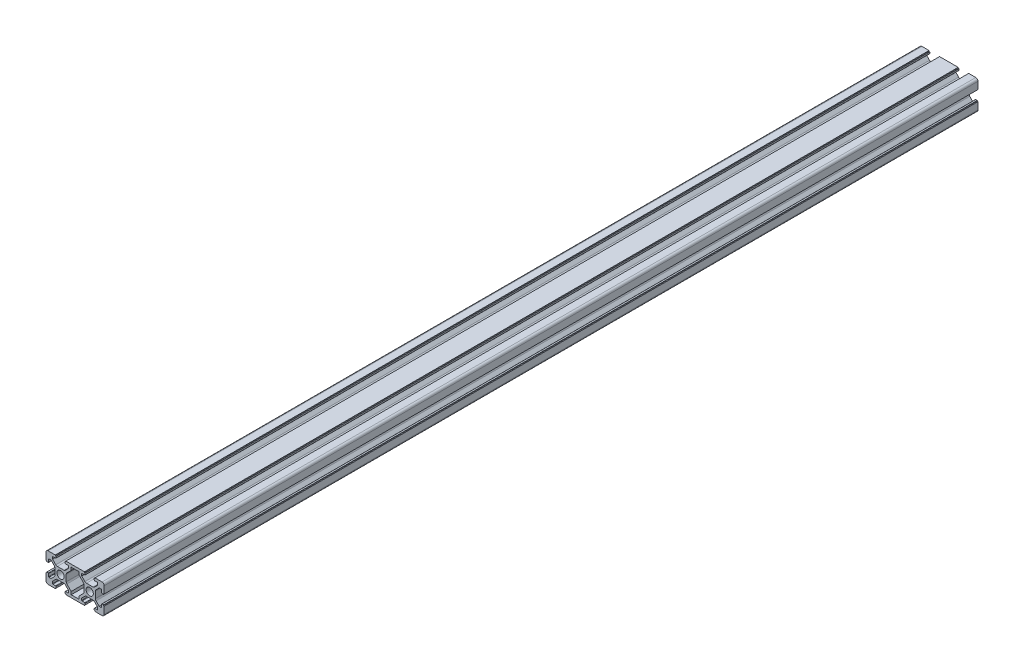
from build123d import *

# Parameters (mm, degrees)
SKETCH_1_R      = 2.5
EXTRUDE_1_DEPTH = 600


with BuildPart() as part:
    # 草图1 → 凸台-拉伸1 (new body)
    with BuildSketch(Plane.XY):
        with BuildLine():
            Line((-0.771587854, 9.545792426), (-5.671587854, 9.545792426))
            Line((-5.671587854, 9.545792426), (-5.671587854, 9.245792426))
            ThreePointArc((-5.671587854, 9.245792426), (-5.730166498, 9.10437107), (-5.871587854, 9.045792426))
            Line((-5.871587854, 9.045792426), (-6.171587854, 9.045792426))
            Line((-6.171587854, 9.045792426), (-6.171587854, 8.045792426))
            ThreePointArc((-6.171587854, 8.045792426), (-6.083719889, 7.833660392), (-5.871587854, 7.745792426))
            Line((-5.871587854, 7.745792426), (-4.071587854, 7.745792426))
            ThreePointArc((-4.071587854, 7.745792426), (-3.85945582, 7.657924461), (-3.771587854, 7.445792426))
            Line((-3.771587854, 7.445792426), (-3.771587854, 6.105792426))
            Line((-3.771587854, 6.105792426), (-5.992248026, 3.885132255))
            ThreePointArc((-5.992248026, 3.885132255), (-6.478883049, 3.559973128), (-7.052908198, 3.445792426))
            Line((-7.052908198, 3.445792426), (-11.490267511, 3.445792426))
            ThreePointArc((-11.490267511, 3.445792426), (-12.064292659, 3.559973128), (-12.550927682, 3.885132255))
            Line((-12.550927682, 3.885132255), (-14.771587854, 6.105792426))
            Line((-14.771587854, 6.105792426), (-14.771587854, 7.445792426))
            ThreePointArc((-14.771587854, 7.445792426), (-14.683719889, 7.657924461), (-14.471587854, 7.745792426))
            Line((-14.471587854, 7.745792426), (-12.671587854, 7.745792426))
            ThreePointArc((-12.671587854, 7.745792426), (-12.45945582, 7.833660392), (-12.371587854, 8.045792426))
            Line((-12.371587854, 8.045792426), (-12.371587854, 9.045792426))
            Line((-12.371587854, 9.045792426), (-12.671587854, 9.045792426))
            ThreePointArc((-12.671587854, 9.045792426), (-12.81300921, 9.10437107), (-12.871587854, 9.245792426))
            Line((-12.871587854, 9.245792426), (-12.871587854, 9.545792426))
            Line((-12.871587854, 9.545792426), (-17.771587854, 9.545792426))
            ThreePointArc((-17.771587854, 9.545792426), (-18.832248026, 9.106452598), (-19.271587854, 8.045792426))
            Line((-19.271587854, 8.045792426), (-19.271587854, 3.145792426))
            Line((-19.271587854, 3.145792426), (-18.971587854, 3.145792426))
            ThreePointArc((-18.971587854, 3.145792426), (-18.830166498, 3.087213783), (-18.771587854, 2.945792426))
            Line((-18.771587854, 2.945792426), (-18.771587854, 2.645792426))
            Line((-18.771587854, 2.645792426), (-17.771587854, 2.645792426))
            ThreePointArc((-17.771587854, 2.645792426), (-17.55945582, 2.733660392), (-17.471587854, 2.945792426))
            Line((-17.471587854, 2.945792426), (-17.471587854, 4.745792426))
            ThreePointArc((-17.471587854, 4.745792426), (-17.383719889, 4.957924461), (-17.171587854, 5.045792426))
            Line((-17.171587854, 5.045792426), (-15.831587854, 5.045792426))
            Line((-15.831587854, 5.045792426), (-13.610927682, 2.825132255))
            ThreePointArc((-13.610927682, 2.825132255), (-13.285768555, 2.338497231), (-13.171587854, 1.764472083))
            Line((-13.171587854, 1.764472083), (-13.171587854, -2.67288723))
            ThreePointArc((-13.171587854, -2.67288723), (-13.285768555, -3.246912379), (-13.610927682, -3.733547402))
            Line((-13.610927682, -3.733547402), (-15.831587854, -5.954207574))
            Line((-15.831587854, -5.954207574), (-17.171587854, -5.954207574))
            ThreePointArc((-17.171587854, -5.954207574), (-17.383719889, -5.866339608), (-17.471587854, -5.654207574))
            Line((-17.471587854, -5.654207574), (-17.471587854, -3.854207574))
            ThreePointArc((-17.471587854, -3.854207574), (-17.55945582, -3.642075539), (-17.771587854, -3.554207574))
            Line((-17.771587854, -3.554207574), (-18.771587854, -3.554207574))
            Line((-18.771587854, -3.554207574), (-18.771587854, -3.854207574))
            ThreePointArc((-18.771587854, -3.854207574), (-18.830166498, -3.99562893), (-18.971587854, -4.054207574))
            Line((-18.971587854, -4.054207574), (-19.271587854, -4.054207574))
            Line((-19.271587854, -4.054207574), (-19.271587854, -8.954207574))
            ThreePointArc((-19.271587854, -8.954207574), (-18.832248026, -10.014867745), (-17.771587854, -10.454207574))
            Line((-17.771587854, -10.454207574), (-12.871587854, -10.454207574))
            Line((-12.871587854, -10.454207574), (-12.871587854, -10.154207574))
            ThreePointArc((-12.871587854, -10.154207574), (-12.81300921, -10.012786217), (-12.671587854, -9.954207574))
            Line((-12.671587854, -9.954207574), (-12.371587854, -9.954207574))
            Line((-12.371587854, -9.954207574), (-12.371587854, -8.954207574))
            ThreePointArc((-12.371587854, -8.954207574), (-12.45945582, -8.742075539), (-12.671587854, -8.654207574))
            Line((-12.671587854, -8.654207574), (-14.471587854, -8.654207574))
            ThreePointArc((-14.471587854, -8.654207574), (-14.683719889, -8.566339608), (-14.771587854, -8.354207574))
            Line((-14.771587854, -8.354207574), (-14.771587854, -7.014207574))
            Line((-14.771587854, -7.014207574), (-12.550927682, -4.793547402))
            ThreePointArc((-12.550927682, -4.793547402), (-12.064292659, -4.468388275), (-11.490267511, -4.354207574))
            Line((-11.490267511, -4.354207574), (-7.052908198, -4.354207574))
            ThreePointArc((-7.052908198, -4.354207574), (-6.478883049, -4.468388275), (-5.992248026, -4.793547402))
            Line((-5.992248026, -4.793547402), (-3.771587854, -7.014207574))
            Line((-3.771587854, -7.014207574), (-3.771587854, -8.354207574))
            ThreePointArc((-3.771587854, -8.354207574), (-3.85945582, -8.566339608), (-4.071587854, -8.654207574))
            Line((-4.071587854, -8.654207574), (-5.871587854, -8.654207574))
            ThreePointArc((-5.871587854, -8.654207574), (-6.083719889, -8.742075539), (-6.171587854, -8.954207574))
            Line((-6.171587854, -8.954207574), (-6.171587854, -9.954207574))
            Line((-6.171587854, -9.954207574), (-5.871587854, -9.954207574))
            ThreePointArc((-5.871587854, -9.954207574), (-5.730166498, -10.012786217), (-5.671587854, -10.154207574))
            Line((-5.671587854, -10.154207574), (-5.671587854, -10.454207574))
            Line((-5.671587854, -10.454207574), (-0.771587854, -10.454207574))
            Line((-0.771587854, -10.454207574), (7.128412146, -10.454207574))
            Line((7.128412146, -10.454207574), (7.128412146, -10.154207574))
            ThreePointArc((7.128412146, -10.154207574), (7.18699079, -10.012786217), (7.328412146, -9.954207574))
            Line((7.328412146, -9.954207574), (7.628412146, -9.954207574))
            Line((7.628412146, -9.954207574), (7.628412146, -8.954207574))
            ThreePointArc((7.628412146, -8.954207574), (7.54054418, -8.742075539), (7.328412146, -8.654207574))
            Line((7.328412146, -8.654207574), (5.528412146, -8.654207574))
            ThreePointArc((5.528412146, -8.654207574), (5.316280111, -8.566339608), (5.228412146, -8.354207574))
            Line((5.228412146, -8.354207574), (5.228412146, -7.014207574))
            Line((5.228412146, -7.014207574), (7.449072318, -4.793547402))
            ThreePointArc((7.449072318, -4.793547402), (7.935707341, -4.468388275), (8.509732489, -4.354207574))
            Line((8.509732489, -4.354207574), (12.947091802, -4.354207574))
            ThreePointArc((12.947091802, -4.354207574), (13.521116951, -4.468388275), (14.007751974, -4.793547402))
            Line((14.007751974, -4.793547402), (16.228412146, -7.014207574))
            Line((16.228412146, -7.014207574), (16.228412146, -8.354207574))
            ThreePointArc((16.228412146, -8.354207574), (16.14054418, -8.566339608), (15.928412146, -8.654207574))
            Line((15.928412146, -8.654207574), (14.128412146, -8.654207574))
            ThreePointArc((14.128412146, -8.654207574), (13.916280111, -8.742075539), (13.828412146, -8.954207574))
            Line((13.828412146, -8.954207574), (13.828412146, -9.954207574))
            Line((13.828412146, -9.954207574), (14.128412146, -9.954207574))
            ThreePointArc((14.128412146, -9.954207574), (14.269833502, -10.012786217), (14.328412146, -10.154207574))
            Line((14.328412146, -10.154207574), (14.328412146, -10.454207574))
            Line((14.328412146, -10.454207574), (19.228412146, -10.454207574))
            ThreePointArc((19.228412146, -10.454207574), (20.289072318, -10.014867745), (20.728412146, -8.954207574))
            Line((20.728412146, -8.954207574), (20.728412146, -4.054207574))
            Line((20.728412146, -4.054207574), (20.428412146, -4.054207574))
            ThreePointArc((20.428412146, -4.054207574), (20.28699079, -3.99562893), (20.228412146, -3.854207574))
            Line((20.228412146, -3.854207574), (20.228412146, -3.554207574))
            Line((20.228412146, -3.554207574), (19.228412146, -3.554207574))
            ThreePointArc((19.228412146, -3.554207574), (19.016280111, -3.642075539), (18.928412146, -3.854207574))
            Line((18.928412146, -3.854207574), (18.928412146, -5.654207574))
            ThreePointArc((18.928412146, -5.654207574), (18.84054418, -5.866339608), (18.628412146, -5.954207574))
            Line((18.628412146, -5.954207574), (17.288412146, -5.954207574))
            Line((17.288412146, -5.954207574), (15.067751974, -3.733547402))
            ThreePointArc((15.067751974, -3.733547402), (14.742592847, -3.246912379), (14.628412146, -2.67288723))
            Line((14.628412146, -2.67288723), (14.628412146, 1.764472083))
            ThreePointArc((14.628412146, 1.764472083), (14.742592847, 2.338497231), (15.067751974, 2.825132255))
            Line((15.067751974, 2.825132255), (17.288412146, 5.045792426))
            Line((17.288412146, 5.045792426), (18.628412146, 5.045792426))
            ThreePointArc((18.628412146, 5.045792426), (18.84054418, 4.957924461), (18.928412146, 4.745792426))
            Line((18.928412146, 4.745792426), (18.928412146, 2.945792426))
            ThreePointArc((18.928412146, 2.945792426), (19.016280111, 2.733660392), (19.228412146, 2.645792426))
            Line((19.228412146, 2.645792426), (20.228412146, 2.645792426))
            Line((20.228412146, 2.645792426), (20.228412146, 2.945792426))
            ThreePointArc((20.228412146, 2.945792426), (20.28699079, 3.087213783), (20.428412146, 3.145792426))
            Line((20.428412146, 3.145792426), (20.728412146, 3.145792426))
            Line((20.728412146, 3.145792426), (20.728412146, 8.045792426))
            ThreePointArc((20.728412146, 8.045792426), (20.289072318, 9.106452598), (19.228412146, 9.545792426))
            Line((19.228412146, 9.545792426), (14.328412146, 9.545792426))
            Line((14.328412146, 9.545792426), (14.328412146, 9.245792426))
            ThreePointArc((14.328412146, 9.245792426), (14.269833502, 9.10437107), (14.128412146, 9.045792426))
            Line((14.128412146, 9.045792426), (13.828412146, 9.045792426))
            Line((13.828412146, 9.045792426), (13.828412146, 8.045792426))
            ThreePointArc((13.828412146, 8.045792426), (13.916280111, 7.833660392), (14.128412146, 7.745792426))
            Line((14.128412146, 7.745792426), (15.928412146, 7.745792426))
            ThreePointArc((15.928412146, 7.745792426), (16.14054418, 7.657924461), (16.228412146, 7.445792426))
            Line((16.228412146, 7.445792426), (16.228412146, 6.105792426))
            Line((16.228412146, 6.105792426), (14.007751974, 3.885132255))
            ThreePointArc((14.007751974, 3.885132255), (13.521116951, 3.559973128), (12.947091802, 3.445792426))
            Line((12.947091802, 3.445792426), (8.509732489, 3.445792426))
            ThreePointArc((8.509732489, 3.445792426), (7.935707341, 3.559973128), (7.449072318, 3.885132255))
            Line((7.449072318, 3.885132255), (5.228412146, 6.105792426))
            Line((5.228412146, 6.105792426), (5.228412146, 7.445792426))
            ThreePointArc((5.228412146, 7.445792426), (5.316280111, 7.657924461), (5.528412146, 7.745792426))
            Line((5.528412146, 7.745792426), (7.328412146, 7.745792426))
            ThreePointArc((7.328412146, 7.745792426), (7.54054418, 7.833660392), (7.628412146, 8.045792426))
            Line((7.628412146, 8.045792426), (7.628412146, 9.045792426))
            Line((7.628412146, 9.045792426), (7.328412146, 9.045792426))
            ThreePointArc((7.328412146, 9.045792426), (7.18699079, 9.10437107), (7.128412146, 9.245792426))
            Line((7.128412146, 9.245792426), (7.128412146, 9.545792426))
            Line((7.128412146, 9.545792426), (2.228412146, 9.545792426))
            Line((2.228412146, 9.545792426), (-0.771587854, 9.545792426))
        make_face()
        with Locations((10.728412146, -0.454207574)):
            Circle(SKETCH_1_R, mode=Mode.SUBTRACT)
        with Locations((-9.271587854, -0.454207574)):
            Circle(SKETCH_1_R, mode=Mode.SUBTRACT)
        with BuildLine():
            Line((-1.971587854, -6.694207574), (-4.932248026, -3.733547402))
            ThreePointArc((-4.932248026, -3.733547402), (-5.257407153, -3.246912379), (-5.371587854, -2.67288723))
            Line((-5.371587854, -2.67288723), (-5.371587854, 1.764472083))
            ThreePointArc((-5.371587854, 1.764472083), (-5.257407153, 2.338497231), (-4.932248026, 2.825132255))
            Line((-4.932248026, 2.825132255), (-1.971587854, 5.785792426))
            Line((-1.971587854, 5.785792426), (-1.971587854, 7.745792426))
            Line((-1.971587854, 7.745792426), (3.428412146, 7.745792426))
            Line((3.428412146, 7.745792426), (3.428412146, 5.785792426))
            Line((3.428412146, 5.785792426), (6.389072318, 2.825132255))
            ThreePointArc((6.389072318, 2.825132255), (6.714231445, 2.338497231), (6.828412146, 1.764472083))
            Line((6.828412146, 1.764472083), (6.828412146, -2.67288723))
            ThreePointArc((6.828412146, -2.67288723), (6.714231445, -3.246912379), (6.389072318, -3.733547402))
            Line((6.389072318, -3.733547402), (3.428412146, -6.694207574))
            Line((3.428412146, -6.694207574), (3.428412146, -8.654207574))
            Line((3.428412146, -8.654207574), (-1.971587854, -8.654207574))
            Line((-1.971587854, -8.654207574), (-1.971587854, -6.694207574))
        make_face(mode=Mode.SUBTRACT)
    extrude(amount=EXTRUDE_1_DEPTH)


solid = part.part
